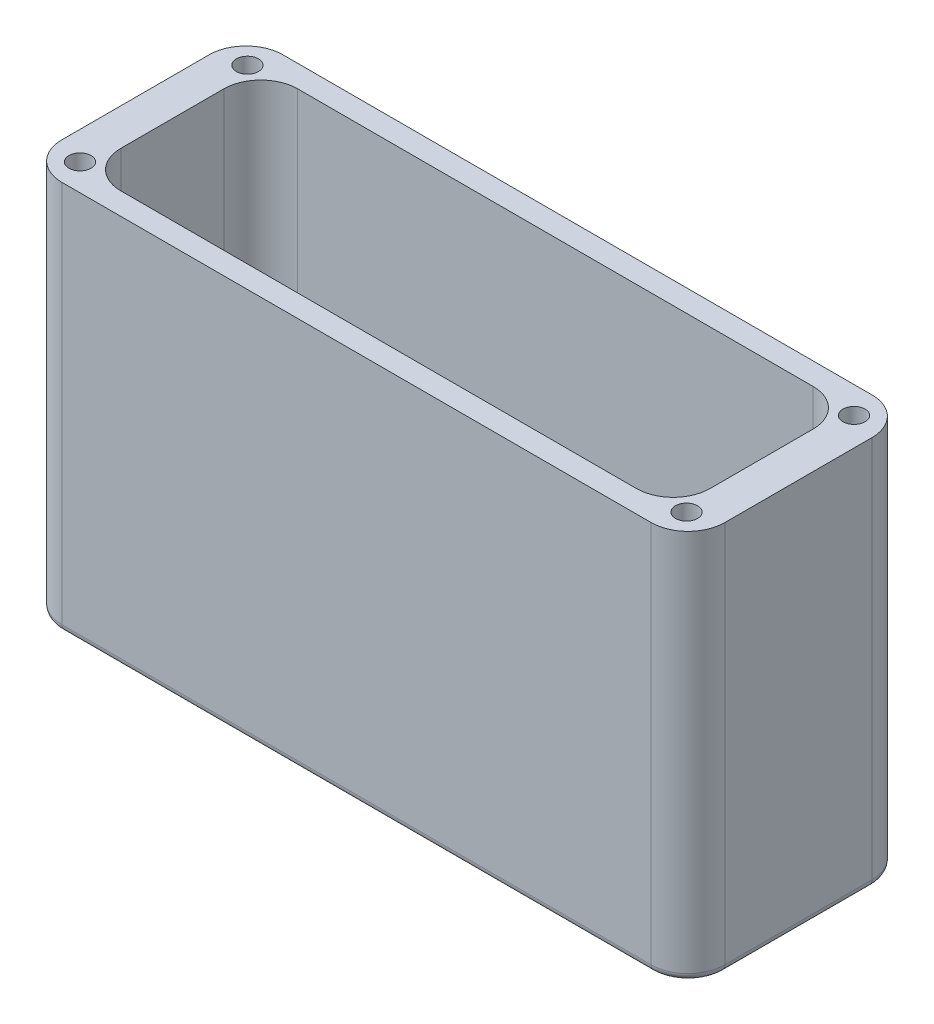
from build123d import *

# Parameters (mm, degrees)
BOSS_EXTRUDE2_DEPTH = 3
BOSS_EXTRUDE3_DEPTH = 50
FILLET3_R           = 1
SKETCH4_R           = 1.5
CUT_EXTRUDE1_DEPTH  = 40
SKETCH5_R           = 4.5
SKETCH5_W           = 40
SKETCH5_H           = 10
CUT_EXTRUDE2_DEPTH  = 10
FILLET4_R           = 2


with BuildPart() as part:
    # Sketch1 → Boss-Extrude2 (new body)
    with BuildSketch(Plane(origin=(0, 0, 0), x_dir=(1, 0, 0), z_dir=(0, 1, 0))):
        with BuildLine():
            Line((-36.64598461, 13.50127958), (43.35401539, 13.50127958))
            ThreePointArc((43.35401539, 13.50127958), (46.889549296, 12.036813486), (48.35401539, 8.50127958))
            Line((48.35401539, 8.50127958), (48.35401539, -11.49872042))
            ThreePointArc((48.35401539, -11.49872042), (46.889549296, -15.034254326), (43.35401539, -16.49872042))
            Line((43.35401539, -16.49872042), (-36.64598461, -16.49872042))
            ThreePointArc((-36.64598461, -16.49872042), (-40.181518516, -15.034254326), (-41.64598461, -11.49872042))
            Line((-41.64598461, -11.49872042), (-41.64598461, 8.50127958))
            ThreePointArc((-41.64598461, 8.50127958), (-40.181518516, 12.036813486), (-36.64598461, 13.50127958))
        make_face()
    extrude(amount=BOSS_EXTRUDE2_DEPTH)

    # Sketch3 → Boss-Extrude3 (add)
    with BuildSketch(Plane(origin=(0, 3, 0), x_dir=(1, 0, 0), z_dir=(0, 1, 0))):
        with BuildLine():
            Line((-36.64598461, -16.49872042), (43.35401539, -16.49872042))
            ThreePointArc((43.35401539, -16.49872042), (46.889549296, -15.034254326), (48.35401539, -11.49872042))
            Line((48.35401539, -11.49872042), (48.35401539, 8.50127958))
            ThreePointArc((48.35401539, 8.50127958), (46.889549296, 12.036813486), (43.35401539, 13.50127958))
            Line((43.35401539, 13.50127958), (-36.64598461, 13.50127958))
            ThreePointArc((-36.64598461, 13.50127958), (-40.181518516, 12.036813486), (-41.64598461, 8.50127958))
            Line((-41.64598461, 8.50127958), (-41.64598461, -11.49872042))
            ThreePointArc((-41.64598461, -11.49872042), (-40.181518516, -15.034254326), (-36.64598461, -16.49872042))
        make_face()
        with BuildLine():
            Line((-36.64598461, 5.50127958), (-36.64598461, -8.49872042))
            ThreePointArc((-36.64598461, -8.49872042), (-35.181518516, -12.034254326), (-31.64598461, -13.49872042))
            Line((-31.64598461, -13.49872042), (38.35401539, -13.49872042))
            ThreePointArc((38.35401539, -13.49872042), (41.889549296, -12.034254326), (43.35401539, -8.49872042))
            Line((43.35401539, -8.49872042), (43.35401539, 5.50127958))
            ThreePointArc((43.35401539, 5.50127958), (41.889549296, 9.036813486), (38.35401539, 10.50127958))
            Line((38.35401539, 10.50127958), (-31.64598461, 10.50127958))
            ThreePointArc((-31.64598461, 10.50127958), (-35.181518516, 9.036813486), (-36.64598461, 5.50127958))
        make_face(mode=Mode.SUBTRACT)
    extrude(amount=BOSS_EXTRUDE3_DEPTH)

    # Fillet3
    fillet3_edges = [part.edges().sort_by_distance(p)[0] for p in [
        (3.35401539, 0, 16.49872042),
        (46.889549296, 0, 15.034254326),
        (48.35401539, 0, 1.49872042),
        (46.889549296, 0, -12.036813486),
        (3.35401539, 0, -13.50127958),
        (-40.181518516, 0, -12.036813486),
        (-41.64598461, 0, 1.49872042),
        (-40.181518516, 0, 15.034254326),
    ]]
    fillet(fillet3_edges, radius=FILLET3_R)

    # Sketch4 → Cut-Extrude1 (cut)
    with BuildSketch(Plane(origin=(0, 53, 0), x_dir=(1, 0, 0), z_dir=(0, 1, 0))):
        with Locations((-37.819946043, 9.867837779)):
            Circle(SKETCH4_R)
        with Locations((-37.819946043, -12.865278618)):
            Circle(SKETCH4_R)
        with Locations((44.527976823, -12.865278618)):
            Circle(SKETCH4_R)
        with Locations((44.527976823, 9.867837779)):
            Circle(SKETCH4_R)
    extrude(amount=-CUT_EXTRUDE1_DEPTH, mode=Mode.SUBTRACT)

    # Sketch5 → Cut-Extrude2 (cut)
    with BuildSketch(Plane.XZ):
        with Locations((33.20043836, 1.111101434)):
            Circle(SKETCH5_R)
        with Locations((-26.79956164, 1.111101434)):
            Circle(SKETCH5_R)
        with Locations((3.20043836, 1.111101434)):
            Rectangle(SKETCH5_W, SKETCH5_H)
    extrude(amount=-CUT_EXTRUDE2_DEPTH, mode=Mode.SUBTRACT)

    # Fillet4
    fillet4_edges = [part.edges().sort_by_distance(p)[0] for p in [
        (43.35401539, 3, 1.49872042),
        (41.889549296, 3, 12.034254326),
        (3.35401539, 3, 13.49872042),
        (-35.181518516, 3, 12.034254326),
        (-36.64598461, 3, 1.49872042),
        (-35.181518516, 3, -9.036813486),
        (3.35401539, 3, -10.50127958),
        (41.889549296, 3, -9.036813486),
        (3.20043836, 3, -3.888898566),
        (-16.79956164, 3, 1.111101434),
        (3.20043836, 3, 6.111101434),
        (23.20043836, 3, 1.111101434),
        (28.70043836, 3, 1.111101434),
        (-31.29956164, 3, 1.111101434),
    ]]
    fillet(fillet4_edges, radius=FILLET4_R)


solid = part.part
